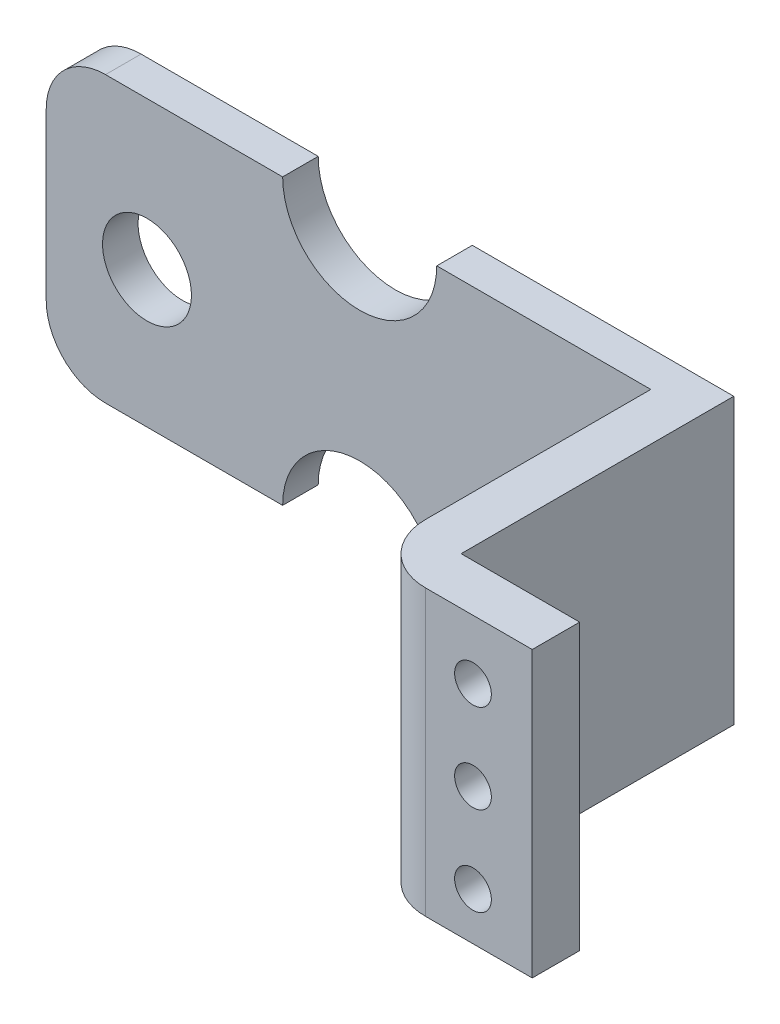
from build123d import *

# Parameters (mm, degrees)
SKETCH1_W           = 55
SKETCH1_H           = 24
SKETCH1_R           = 3.75
BOSS_EXTRUDE1_DEPTH = 3
SKETCH3_W           = 4
SKETCH3_H           = 24
BOSS_EXTRUDE2_DEPTH = 24
SKETCH4_W           = 4
SKETCH4_H           = 24
BOSS_EXTRUDE3_DEPTH = 10
SKETCH5_R           = 1.55
CUT_EXTRUDE1_DEPTH  = 10
CUT_EXTRUDE2_REACH  = 48.111
SKETCH6_R           = 6.5
FILLET1_R           = 5


with BuildPart() as part:
    # Sketch1 → Boss-Extrude1 (new body)
    with BuildSketch(Plane.XY):
        Rectangle(SKETCH1_W, SKETCH1_H)
        with Locations((-19, -0.5)):
            Circle(SKETCH1_R, mode=Mode.SUBTRACT)
        with Locations((17, -0.5)):
            Circle(SKETCH1_R, mode=Mode.SUBTRACT)
    extrude(amount=BOSS_EXTRUDE1_DEPTH)

    # Sketch3 → Boss-Extrude2 (add)
    with BuildSketch(Plane.XY.offset(3)):
        with Locations((25.5, 0)):
            Rectangle(SKETCH3_W, SKETCH3_H)
    extrude(amount=BOSS_EXTRUDE2_DEPTH)

    # Sketch4 → Boss-Extrude3 (add)
    with BuildSketch(Plane(origin=(27.5, 0, 0), x_dir=(0, 0, -1), z_dir=(1, 0, 0))):
        with Locations((-25, 0)):
            Rectangle(SKETCH4_W, SKETCH4_H)
    extrude(amount=BOSS_EXTRUDE3_DEPTH)

    # Sketch5 → Cut-Extrude1 (cut)
    with BuildSketch(Plane.XY.offset(27)):
        with Locations((32.5, 7)):
            Circle(SKETCH5_R)
        with Locations((32.5, -0.5)):
            Circle(SKETCH5_R)
        with Locations((32.5, -8)):
            Circle(SKETCH5_R)
    extrude(amount=-CUT_EXTRUDE1_DEPTH, mode=Mode.SUBTRACT)

    # Sketch6 → Cut-Extrude2 (cut, up to next)
    with BuildSketch(Plane.XY.offset(3), mode=Mode.PRIVATE) as cut_extrude2_sk1:
        with Locations((-1.056622026, 12)):
            Circle(SKETCH6_R)
    cut_extrude2_tool1 = extrude(cut_extrude2_sk1.sketch, amount=-CUT_EXTRUDE2_REACH, mode=Mode.PRIVATE) & part.part
    # Sketch6 → Cut-Extrude2 (cut, up to next)
    with BuildSketch(Plane.XY.offset(3), mode=Mode.PRIVATE) as cut_extrude2_sk2:
        with Locations((-1.056622026, -12)):
            Circle(SKETCH6_R)
    cut_extrude2_tool2 = extrude(cut_extrude2_sk2.sketch, amount=-CUT_EXTRUDE2_REACH, mode=Mode.PRIVATE) & part.part
    add(cut_extrude2_tool1.solids().sort_by_distance((-1.056622, 12, 3))[0], mode=Mode.SUBTRACT)
    add(cut_extrude2_tool2.solids().sort_by_distance((-1.056622, -12, 3))[0], mode=Mode.SUBTRACT)

    # Fillet1
    fillet1_edges = [part.edges().sort_by_distance(p)[0] for p in [
        (23.5, 0, 27),
        (-27.5, 12, 1.5),
        (-27.5, -12, 1.5),
    ]]
    fillet(fillet1_edges, radius=FILLET1_R)


solid = part.part
